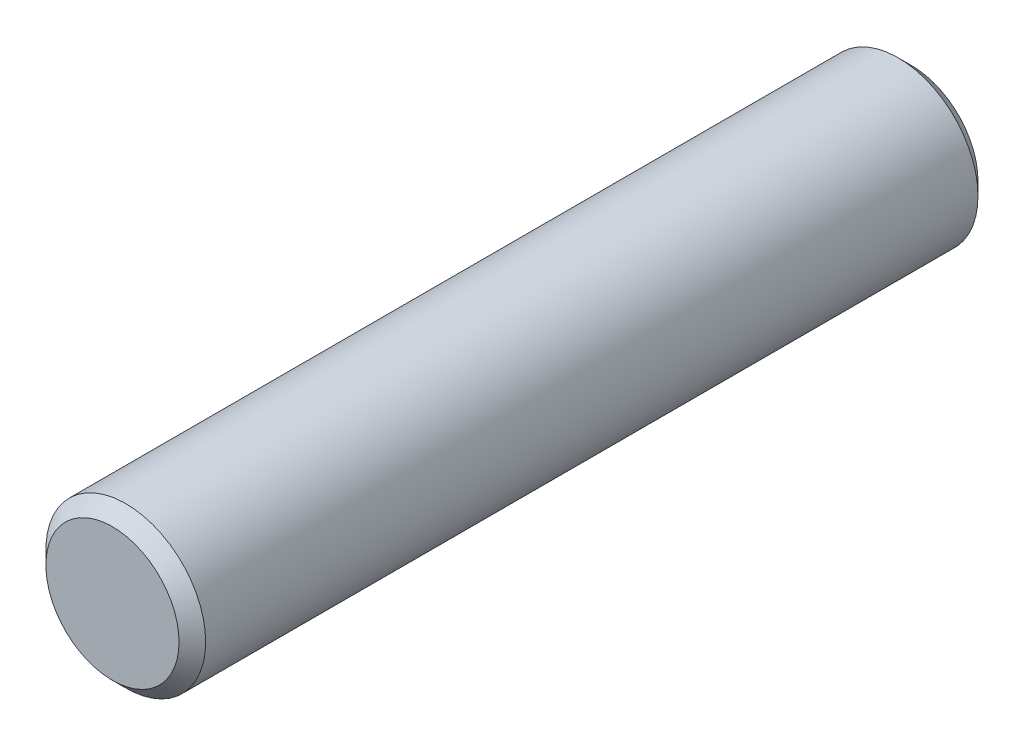
from build123d import *

# Parameters (mm, degrees)
SKETCH1_R           = 3
BOSS_EXTRUDE1_DEPTH = 15
CHAMFER1_SIZE       = 0.5


with BuildPart() as part:
    # Sketch1 → Boss-Extrude1 (new, symmetric)
    with BuildSketch(Plane.XY):
        Circle(SKETCH1_R)
    extrude(amount=BOSS_EXTRUDE1_DEPTH, both=True)

    # Chamfer1
    chamfer1_edges = [part.edges().sort_by_distance(p)[0] for p in [
        (-3, 0, -15),
        (-3, 0, 15),
    ]]
    chamfer(chamfer1_edges, length=CHAMFER1_SIZE)


solid = part.part
